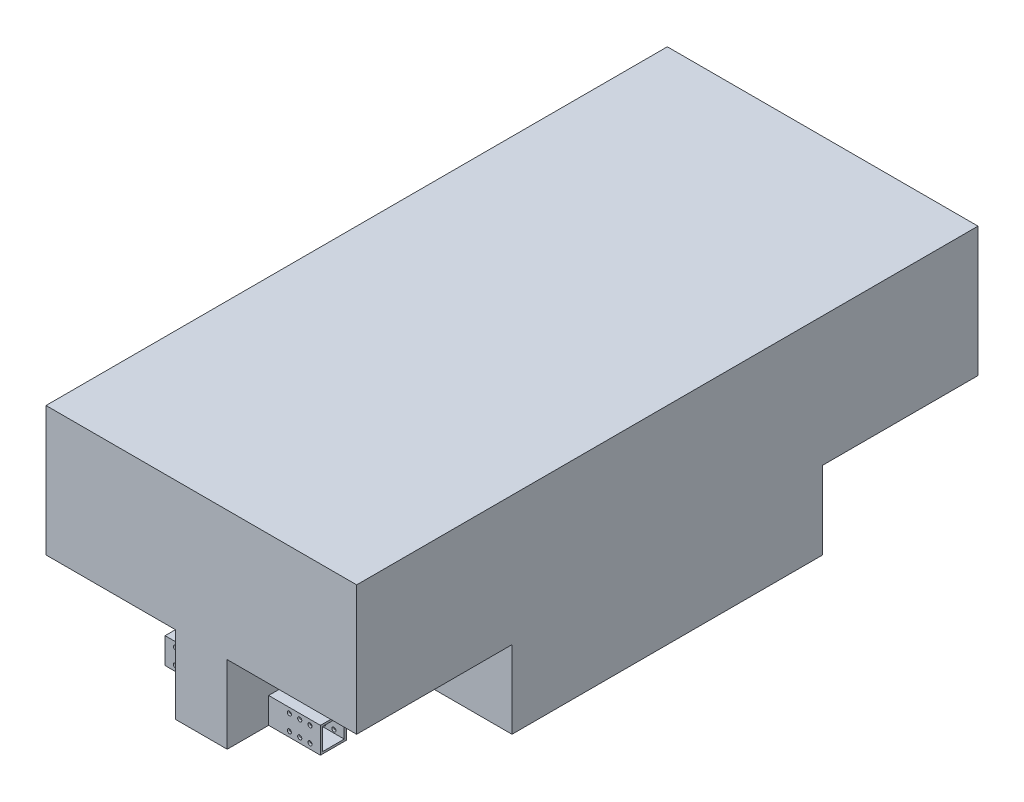
from build123d import *

# Parameters (mm, degrees)
BOSS_EXTRUDE1_DEPTH       = 150
BOSS_EXTRUDE1_DEPTH_BACK  = 150
SKETCH2_W                 = 600
SKETCH2_H                 = 200
SKETCH3_W                 = 150
SKETCH3_H                 = 75
CUT_EXTRUDE1_DEPTH        = 125
SKETCH4_W                 = 25
SKETCH4_H                 = 25
SKETCH4_W_2               = 21
SKETCH4_H_2               = 21
BOSS_EXTRUDE2_DEPTH       = 50
SKETCH5_R                 = 2
CUT_EXTRUDE2_DEPTH        = 25
MIRROR3_COPY_1_SKETCH_W   = 25
MIRROR3_COPY_1_SKETCH_H   = 25
MIRROR3_COPY_1_SKETCH_W_2 = 21
MIRROR3_COPY_1_SKETCH_H_2 = 21
MIRROR3_COPY_1_DEPTH      = 50
MIRROR3_COPY_2_SKETCH_R   = 2
MIRROR3_COPY_2_DEPTH      = 25


with BuildPart() as part:
    # Sketch2 → Boss-Extrude1 (new, two sides: drawn at the far end of the back side and taken through both)
    with BuildSketch(Plane(origin=(0, 0, 0), x_dir=(0, 0, -1), z_dir=(1, 0, 0)).offset(-BOSS_EXTRUDE1_DEPTH_BACK)):
        Rectangle(SKETCH2_W, SKETCH2_H)
    extrude(amount=BOSS_EXTRUDE1_DEPTH + BOSS_EXTRUDE1_DEPTH_BACK)

    # Sketch3 → Cut-Extrude1 (cut)
    with BuildSketch(Plane(origin=(150, 0, 0), x_dir=(0, 0, -1), z_dir=(1, 0, 0))):
        with Locations((-225, -62.5)):
            Rectangle(SKETCH3_W, SKETCH3_H)
        with Locations((225, -62.5)):
            Rectangle(SKETCH3_W, SKETCH3_H)
    cut_extrude1 = extrude(amount=-CUT_EXTRUDE1_DEPTH, mode=Mode.SUBTRACT)

    # Mirror1: Cut-Extrude1 across plane
    add(cut_extrude1.mirror(Plane(origin=(0, 0, 0), x_dir=(0, 0, 1), z_dir=(1, 0, 0))), mode=Mode.SUBTRACT)

    # Sketch4 → Boss-Extrude2 (add)
    with BuildSketch(Plane(origin=(25, 0, 0), x_dir=(0, 0, -1), z_dir=(1, 0, 0))):
        with Locations((-247.5, -87.5)):
            Rectangle(SKETCH4_W, SKETCH4_H)
        with Locations((-247.5, -87.5)):
            Rectangle(SKETCH4_W_2, SKETCH4_H_2, mode=Mode.SUBTRACT)
    boss_extrude2 = extrude(amount=BOSS_EXTRUDE2_DEPTH)

    # Sketch5 → Cut-Extrude2 (cut)
    with BuildSketch(Plane.XY.offset(260)):
        with Locations((65, -80)):
            Circle(SKETCH5_R)
        with Locations((55, -80)):
            Circle(SKETCH5_R)
        with Locations((45, -80)):
            Circle(SKETCH5_R)
        with Locations((65, -95)):
            Circle(SKETCH5_R)
        with Locations((55, -95)):
            Circle(SKETCH5_R)
        with Locations((45, -95)):
            Circle(SKETCH5_R)
    cut_extrude2 = extrude(amount=-CUT_EXTRUDE2_DEPTH, mode=Mode.SUBTRACT)

    # Mirror2: Boss-Extrude2, Cut-Extrude2 across plane
    add(boss_extrude2.mirror(Plane(origin=(0, 0, 0), x_dir=(0, 0, 1), z_dir=(1, 0, 0))))
    add(cut_extrude2.mirror(Plane(origin=(0, 0, 0), x_dir=(0, 0, 1), z_dir=(1, 0, 0))), mode=Mode.SUBTRACT)

    # Mirror3: Boss-Extrude2, Cut-Extrude2 across plane
    add(boss_extrude2.mirror(Plane.XY))
    add(cut_extrude2.mirror(Plane.XY), mode=Mode.SUBTRACT)

    # Mirror3 copy 1 sketch → Mirror3 copy 1 (add)
    with BuildSketch(Plane.ZY.offset(25)):
        with Locations((-247.5, -87.5)):
            Rectangle(MIRROR3_COPY_1_SKETCH_W, MIRROR3_COPY_1_SKETCH_H)
        with Locations((-247.5, -87.5)):
            Rectangle(MIRROR3_COPY_1_SKETCH_W_2, MIRROR3_COPY_1_SKETCH_H_2, mode=Mode.SUBTRACT)
    extrude(amount=MIRROR3_COPY_1_DEPTH)

    # Mirror3 copy 2 sketch → Mirror3 copy 2 (cut)
    with BuildSketch(Plane(origin=(0, 0, -260), x_dir=(-1, 0, 0), z_dir=(0, 0, -1))):
        with Locations((65, -80)):
            Circle(MIRROR3_COPY_2_SKETCH_R)
        with Locations((55, -80)):
            Circle(MIRROR3_COPY_2_SKETCH_R)
        with Locations((45, -80)):
            Circle(MIRROR3_COPY_2_SKETCH_R)
        with Locations((65, -95)):
            Circle(MIRROR3_COPY_2_SKETCH_R)
        with Locations((55, -95)):
            Circle(MIRROR3_COPY_2_SKETCH_R)
        with Locations((45, -95)):
            Circle(MIRROR3_COPY_2_SKETCH_R)
    extrude(amount=-MIRROR3_COPY_2_DEPTH, mode=Mode.SUBTRACT)


solid = part.part
